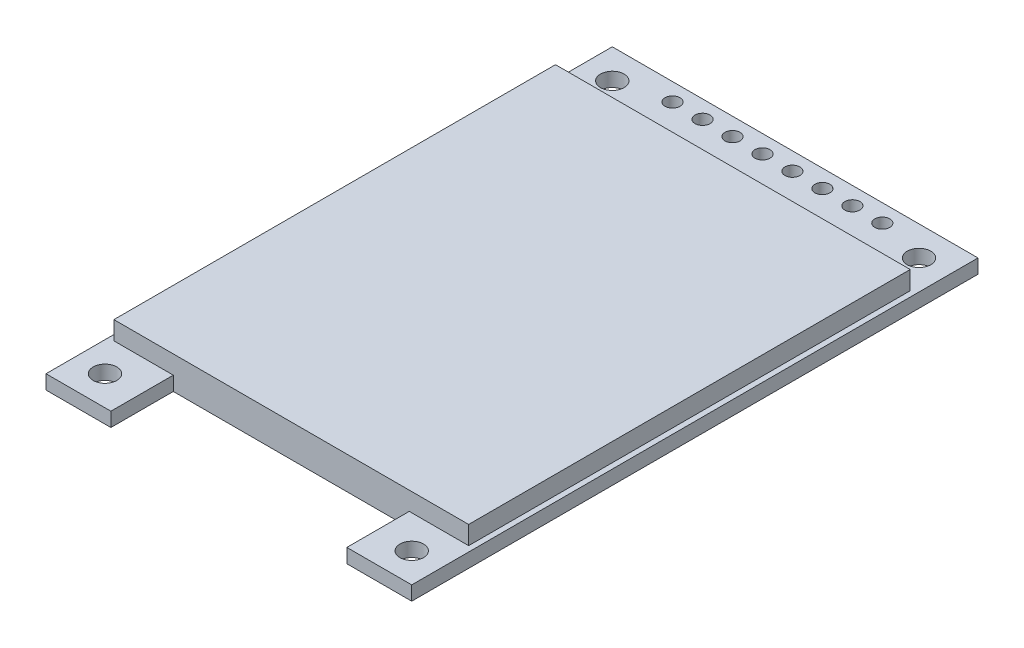
from build123d import *

# Parameters (mm, degrees)
SKETCH_1_W             = 31
SKETCH_1_H             = 48
EXTRUDE_1_DEPTH        = 1.2
SKETCH_2_W             = 30.07
SKETCH_2_H             = 37.43
EXTRUDE_2_DEPTH        = 1.56
SKETCH_4_R             = 0.635
CUT_EXTRUDE_1_DEPTH    = 58.16146954
PATTERN_LINEAR_1_COUNT = 8
PATTERN_LINEAR_1_PITCH = 2.54
SKETCH_6_R             = 1
SKETCH_6_W             = 20
SKETCH_6_H             = 5.29
CUT_EXTRUDE_2_DEPTH    = 58.16146954


with BuildPart() as part:
    # 草图1 → 凸台-拉伸1 (new body)
    with BuildSketch(Plane(origin=(0, 0, 0), x_dir=(1, 0, 0), z_dir=(0, 1, 0))):
        with Locations((15.5, 24)):
            Rectangle(SKETCH_1_W, SKETCH_1_H)
    extrude(amount=EXTRUDE_1_DEPTH)

    # 草图2 → 凸台-拉伸2 (add)
    with BuildSketch(Plane(origin=(0, 1.2, 0), x_dir=(1, 0, 0), z_dir=(0, 1, 0))):
        with Locations((15.5, 24.005)):
            Rectangle(SKETCH_2_W, SKETCH_2_H)
    extrude(amount=EXTRUDE_2_DEPTH)

    # 草图4 → 切除-拉伸1 (cut, through all)
    with BuildSketch(Plane(origin=(0, 1.2, 0), x_dir=(1, 0, 0), z_dir=(0, 1, 0))):
        with Locations(Location((6.61, 46.5, 0), (0, 0, 270))):
            Circle(SKETCH_4_R)
    cut_extrude_1 = extrude(amount=-CUT_EXTRUDE_1_DEPTH, mode=Mode.SUBTRACT)

    # 阵列(线性)1: 切除-拉伸1 ×8
    with Locations(*[(i * PATTERN_LINEAR_1_PITCH, 0, 0) for i in range(1, PATTERN_LINEAR_1_COUNT)]):
        add(cut_extrude_1, mode=Mode.SUBTRACT)

    # 草图6 → 切除-拉伸2 (cut, through all)
    with BuildSketch(Plane(origin=(0, 1.2, 0), x_dir=(1, 0, 0), z_dir=(0, 1, 0))):
        with Locations(Location((2.5, 45.5, 0), (0, 0, 270))):
            Circle(SKETCH_6_R)
        with Locations(Location((28.5, 45.5, 0), (0, 0, 270))):
            Circle(SKETCH_6_R)
        with Locations(Location((2.5, 2.5, 0), (0, 0, 270))):
            Circle(SKETCH_6_R)
        with Locations(Location((28.5, 2.5, 0), (0, 0, 270))):
            Circle(SKETCH_6_R)
        with Locations((15.5, 2.645)):
            Rectangle(SKETCH_6_W, SKETCH_6_H)
    extrude(amount=-CUT_EXTRUDE_2_DEPTH, mode=Mode.SUBTRACT)


solid = part.part
